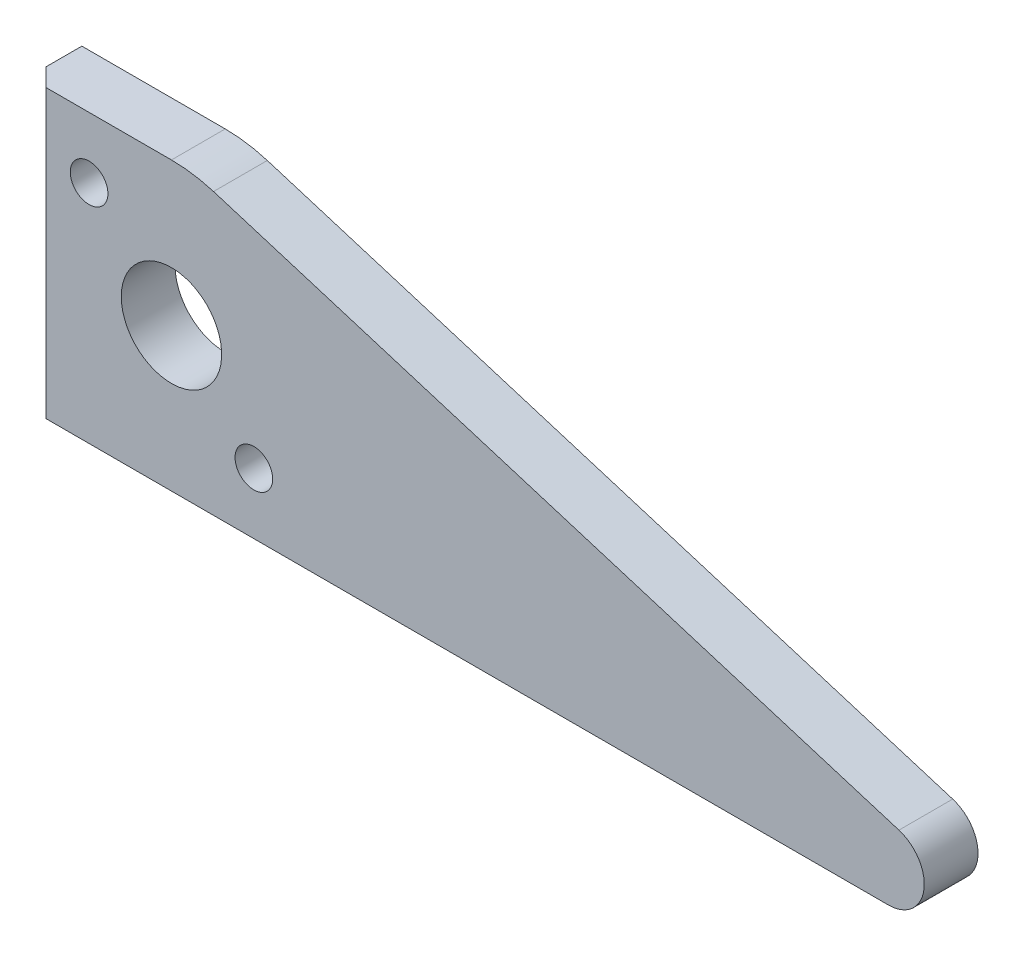
from build123d import *

# Parameters (mm, degrees)
ESTRUSIONE1_DEPTH        = 15
SMUSSO1_SIZE             = 5
SCHIZZO2_R               = 14
TAGLIO_ESTRUSIONE1_DEPTH = 59.523499554
SCHIZZO4_R               = 3
TAGLIO_ESTRUSIONE3_DEPTH = 20
SCHIZZO5_R               = 5.25
TAGLIO_ESTRUSIONE4_DEPTH = 8.5
ESTRUSIONE2_START        = -15
ESTRUSIONE2_DEPTH        = 15
SCHIZZO9_R               = 3
TAGLIO_ESTRUSIONE7_DEPTH = 10


with BuildPart() as part:
    # Schizzo1 → Estrusione1 (new body)
    with BuildSketch(Plane.XY):
        with BuildLine():
            Line((-40, 40), (0, 40))
            ThreePointArc((0, 40), (40, 0), (0, -40))
            Line((0, -40), (-40, -40))
            Line((-40, -40), (-40, 40))
        make_face()
    extrude(amount=ESTRUSIONE1_DEPTH)

    # Smusso1
    smusso1_edges = [part.edges().sort_by_distance(p)[0] for p in [
        (-40, 0, 15),
    ]]
    chamfer(smusso1_edges, length=SMUSSO1_SIZE)

    # Schizzo2 → Taglio-Estrusione1 (cut, through all)
    with BuildSketch(Plane(origin=(0, 0, 0), x_dir=(-1, 0, 0), z_dir=(0, 0, -1))):
        Circle(SCHIZZO2_R)
    extrude(amount=-TAGLIO_ESTRUSIONE1_DEPTH, mode=Mode.SUBTRACT)

    # Schizzo4 → Taglio-Estrusione3 (cut)
    with BuildSketch(Plane.XY.offset(15)):
        with Locations((-22.980970389, 22.980970389)):
            Circle(SCHIZZO4_R)
        with Locations((22.980970389, -22.980970389)):
            Circle(SCHIZZO4_R)
    extrude(amount=-TAGLIO_ESTRUSIONE3_DEPTH, mode=Mode.SUBTRACT)

    # Schizzo5 → Taglio-Estrusione4 (cut)
    with BuildSketch(Plane.XY.offset(15)):
        with Locations((-22.980970389, 22.980970389)):
            Circle(SCHIZZO5_R)
        with Locations(Location((22.980970389, -22.980970389, 0), (0, 0, 180))):
            Circle(SCHIZZO5_R)
    extrude(amount=-TAGLIO_ESTRUSIONE4_DEPTH, mode=Mode.SUBTRACT)

    # Schizzo6 → Estrusione2 (add)
    with BuildSketch(Plane.XY.offset(15).offset(ESTRUSIONE2_START)):
        with BuildLine():
            Line((11.73594132, 38.239608802), (202.93398533, -20.4400978))
            ThreePointArc((202.93398533, -20.4400978), (209.889363529, -31.483404529), (200, -40))
            Line((200, -40), (0, -40))
            ThreePointArc((0, -40), (39.557454115, -5.933618117), (11.73594132, 38.239608802))
        make_face()
    extrude(amount=ESTRUSIONE2_DEPTH)

    # Schizzo9 → Taglio-Estrusione7 (cut)
    with BuildSketch(Plane(origin=(0, 0, 0), x_dir=(-1, 0, 0), z_dir=(0, 0, -1))):
        with Locations((-57, -8.648405099)):
            Circle(SCHIZZO9_R)
        with Locations((-138.285904257, -33.5)):
            Circle(SCHIZZO9_R)
    extrude(amount=-TAGLIO_ESTRUSIONE7_DEPTH, mode=Mode.SUBTRACT)


solid = part.part
